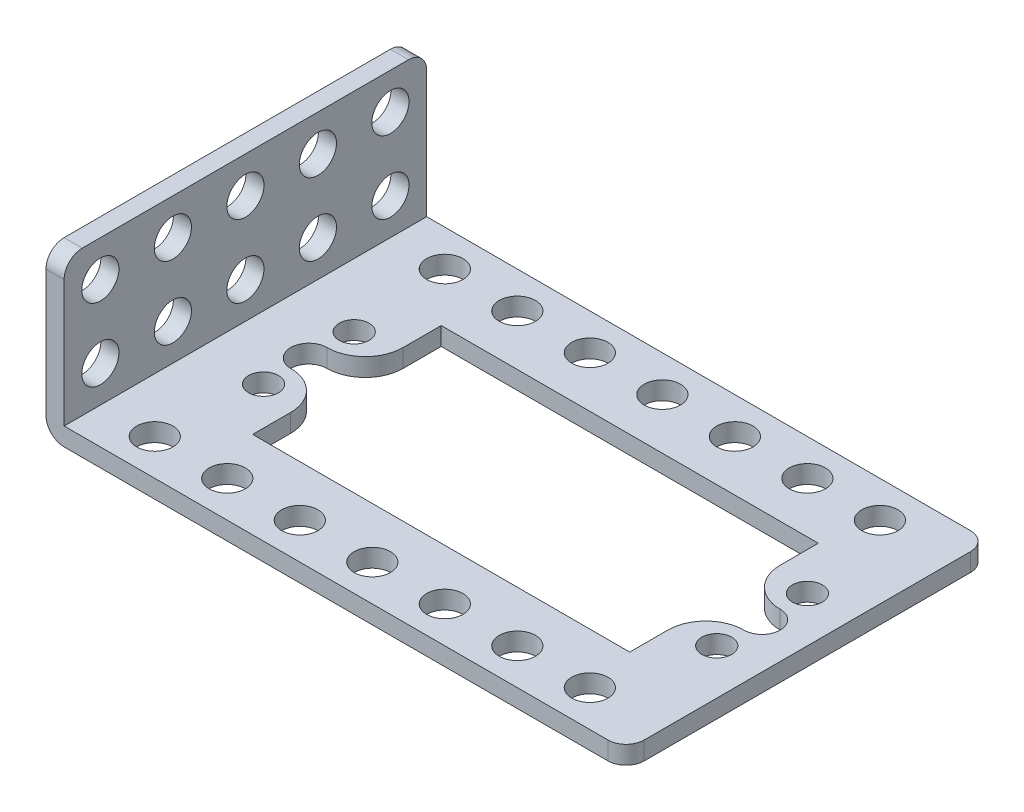
from build123d import *

# Parameters (mm, degrees)
SKETCH1_W                       = 64
SKETCH1_H                       = 40
BOSS_EXTRUDE1_DEPTH             = 2
SKETCH2_W                       = 2
SKETCH2_H                       = 40
BOSS_EXTRUDE2_DEPTH             = 16
SKETCH3_R                       = 2
CUT_EXTRUDE1_DEPTH              = 78.149206088
LPATTERN1_COUNT                 = 7
LPATTERN1_PITCH                 = 8
MIRROR1_COPY_1_SKETCH_R         = 2
MIRROR1_COPY_1_DEPTH            = 78.149206088
MIRROR1_COPY_2_SKETCH_R         = 2
MIRROR1_COPY_2_DEPTH            = 78.149206088
MIRROR1_COPY_3_SKETCH_R         = 2
MIRROR1_COPY_3_DEPTH            = 78.149206088
MIRROR1_COPY_4_SKETCH_R         = 2
MIRROR1_COPY_4_DEPTH            = 78.149206088
MIRROR1_COPY_5_SKETCH_R         = 2
MIRROR1_COPY_5_DEPTH            = 78.149206088
MIRROR1_COPY_6_SKETCH_R         = 2
MIRROR1_COPY_6_DEPTH            = 78.149206088
CUT_EXTRUDE2_DEPTH              = 78.149206088
TAP_DRILL_FOR_M4X0_7_TAP1_D     = 3.3
TAP_DRILL_FOR_M4X0_7_TAP1_DEPTH = 10.76
SKETCH7_R                       = 2.05
CUT_EXTRUDE3_DEPTH              = 76.947350184
LPATTERN2_COUNT                 = 5
LPATTERN2_PITCH                 = 8
LPATTERN2_COUNT_DIR2            = 2
LPATTERN2_PITCH_DIR2            = 8
FILLET1_R                       = 2


with BuildPart() as part:
    # Sketch1 → Boss-Extrude1 (new body)
    with BuildSketch(Plane(origin=(0, 0, 0), x_dir=(1, 0, 0), z_dir=(0, 1, 0))):
        with Locations((32, 20)):
            Rectangle(SKETCH1_W, SKETCH1_H)
    extrude(amount=BOSS_EXTRUDE1_DEPTH)

    # Sketch2 → Boss-Extrude2 (add)
    with BuildSketch(Plane(origin=(0, 2, 0), x_dir=(1, 0, 0), z_dir=(0, 1, 0))):
        with Locations((1, 20)):
            Rectangle(SKETCH2_W, SKETCH2_H)
    extrude(amount=BOSS_EXTRUDE2_DEPTH)

    # Sketch3 → Cut-Extrude1 (cut, through all)
    with BuildSketch(Plane(origin=(0, 2, 0), x_dir=(1, 0, 0), z_dir=(0, 1, 0))):
        with Locations(Location((8, 36, 0), (0, 0, 270))):
            Circle(SKETCH3_R)
    cut_extrude1 = extrude(amount=-CUT_EXTRUDE1_DEPTH, mode=Mode.SUBTRACT)

    # LPattern1: Cut-Extrude1 ×7
    with Locations(*[(i * LPATTERN1_PITCH, 0, 0) for i in range(1, LPATTERN1_COUNT)]):
        add(cut_extrude1, mode=Mode.SUBTRACT)

    # Mirror1: Cut-Extrude1 across plane
    add(cut_extrude1.mirror(Plane(origin=(0, 0, -20), x_dir=(1, 0, 0), z_dir=(0, 0, -1))), mode=Mode.SUBTRACT)

    # Mirror1 copy 1 sketch → Mirror1 copy 1 (cut, through all)
    with BuildSketch(Plane(origin=(8, 2, -40), x_dir=(1, 0, 0), z_dir=(0, 1, 0))):
        with Locations((8, -36)):
            Circle(MIRROR1_COPY_1_SKETCH_R)
    extrude(amount=-MIRROR1_COPY_1_DEPTH, mode=Mode.SUBTRACT)

    # Mirror1 copy 2 sketch → Mirror1 copy 2 (cut, through all)
    with BuildSketch(Plane(origin=(16, 2, -40), x_dir=(1, 0, 0), z_dir=(0, 1, 0))):
        with Locations((8, -36)):
            Circle(MIRROR1_COPY_2_SKETCH_R)
    extrude(amount=-MIRROR1_COPY_2_DEPTH, mode=Mode.SUBTRACT)

    # Mirror1 copy 3 sketch → Mirror1 copy 3 (cut, through all)
    with BuildSketch(Plane(origin=(24, 2, -40), x_dir=(1, 0, 0), z_dir=(0, 1, 0))):
        with Locations((8, -36)):
            Circle(MIRROR1_COPY_3_SKETCH_R)
    extrude(amount=-MIRROR1_COPY_3_DEPTH, mode=Mode.SUBTRACT)

    # Mirror1 copy 4 sketch → Mirror1 copy 4 (cut, through all)
    with BuildSketch(Plane(origin=(32, 2, -40), x_dir=(1, 0, 0), z_dir=(0, 1, 0))):
        with Locations((8, -36)):
            Circle(MIRROR1_COPY_4_SKETCH_R)
    extrude(amount=-MIRROR1_COPY_4_DEPTH, mode=Mode.SUBTRACT)

    # Mirror1 copy 5 sketch → Mirror1 copy 5 (cut, through all)
    with BuildSketch(Plane(origin=(40, 2, -40), x_dir=(1, 0, 0), z_dir=(0, 1, 0))):
        with Locations((8, -36)):
            Circle(MIRROR1_COPY_5_SKETCH_R)
    extrude(amount=-MIRROR1_COPY_5_DEPTH, mode=Mode.SUBTRACT)

    # Mirror1 copy 6 sketch → Mirror1 copy 6 (cut, through all)
    with BuildSketch(Plane(origin=(48, 2, -40), x_dir=(1, 0, 0), z_dir=(0, 1, 0))):
        with Locations((8, -36)):
            Circle(MIRROR1_COPY_6_SKETCH_R)
    extrude(amount=-MIRROR1_COPY_6_DEPTH, mode=Mode.SUBTRACT)

    # Sketch4 → Cut-Extrude2 (cut, through all)
    with BuildSketch(Plane(origin=(0, 2, 0), x_dir=(1, 0, 0), z_dir=(0, 1, 0))):
        with BuildLine():
            Line((13.2, 30.4), (54.8, 30.4))
            Line((54.8, 30.4), (54.8, 26.2))
            ThreePointArc((54.8, 26.2), (56.030151519, 23.230151519), (59, 22))
            ThreePointArc((59, 22), (61, 20), (59, 18))
            ThreePointArc((59, 18), (56.030151519, 16.769848481), (54.8, 13.8))
            Line((54.8, 13.8), (54.8, 9.6))
            Line((54.8, 9.6), (13.2, 9.6))
            Line((13.2, 9.6), (13.2, 13.8))
            ThreePointArc((13.2, 13.8), (11.969848481, 16.769848481), (9, 18))
            ThreePointArc((9, 18), (7, 20), (9, 22))
            ThreePointArc((9, 22), (11.969848481, 23.230151519), (13.2, 26.2))
            Line((13.2, 26.2), (13.2, 30.4))
        make_face()
    extrude(amount=-CUT_EXTRUDE2_DEPTH, mode=Mode.SUBTRACT)

    # Tap Drill for M4x0.7 Tap1
    with Locations(Plane(origin=(0, 2, 0), x_dir=(1, 0, 0), z_dir=(0, 1, 0))):
        with Locations((9, 25), (9, 15), (59, 15), (59, 25)):
            Hole(TAP_DRILL_FOR_M4X0_7_TAP1_D / 2, depth=TAP_DRILL_FOR_M4X0_7_TAP1_DEPTH)

    # Sketch7 → Cut-Extrude3 (cut, through all)
    with BuildSketch(Plane(origin=(2, 0, 0), x_dir=(0, 0, -1), z_dir=(1, 0, 0))):
        with Locations((4, 14)):
            Circle(SKETCH7_R)
    cut_extrude3 = extrude(amount=-CUT_EXTRUDE3_DEPTH, mode=Mode.SUBTRACT)

    # LPattern2: Cut-Extrude3 5 × 2
    with Locations(*[(0, -j * LPATTERN2_PITCH_DIR2, -i * LPATTERN2_PITCH) for i in range(LPATTERN2_COUNT) for j in range(LPATTERN2_COUNT_DIR2) if (i, j) != (0, 0)]):
        add(cut_extrude3, mode=Mode.SUBTRACT)

    # Fillet1
    fillet1_edges = [part.edges().sort_by_distance(p)[0] for p in [
        (1, 18, 0),
        (1, 18, -40),
        (0, 0, -20),
        (64, 1, -40),
        (64, 1, 0),
    ]]
    fillet(fillet1_edges, radius=FILLET1_R)


solid = part.part
